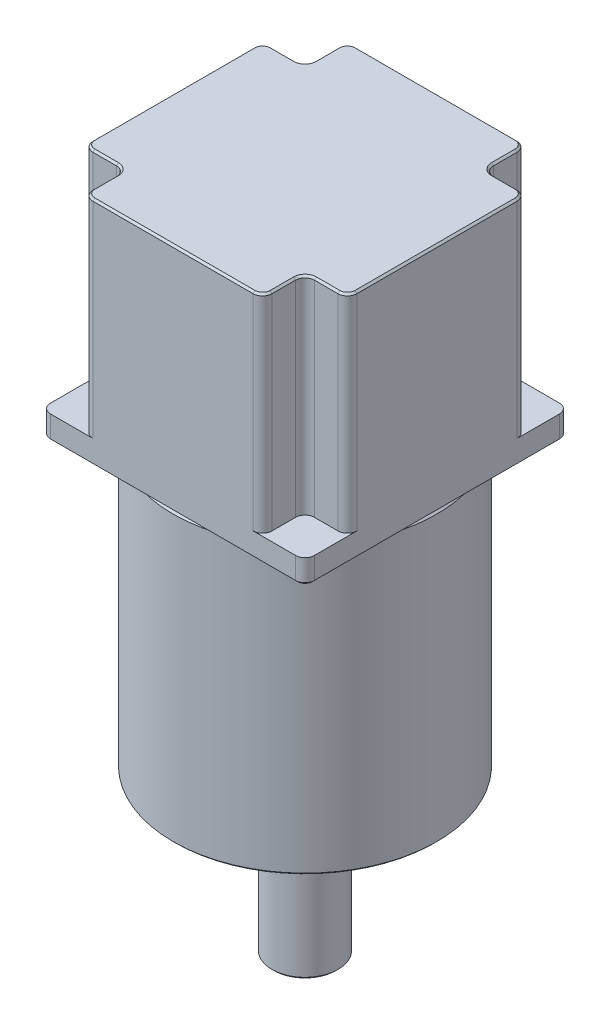
from build123d import *

# Parameters (mm, degrees)
SKETCH1_W           = 56
SKETCH1_H           = 56
BOSS_EXTRUDE1_DEPTH = 5
BOSS_EXTRUDE2_DEPTH = 44
FILLET1_R           = 2
CHAMFER1_SIZE       = 0.4
SKETCH3_R           = 28
BOSS_EXTRUDE3_DEPTH = 61
CHAMFER2_SIZE       = 0.4
SKETCH4_R           = 7
BOSS_EXTRUDE4_DEPTH = 34
CHAMFER3_SIZE       = 0.4


with BuildPart() as part:
    # Sketch1 → Boss-Extrude1 (new body)
    with BuildSketch(Plane(origin=(0, 0, 0), x_dir=(1, 0, 0), z_dir=(0, 1, 0))):
        Rectangle(SKETCH1_W, SKETCH1_H)
    extrude(amount=BOSS_EXTRUDE1_DEPTH)

    # Sketch2 → Boss-Extrude2 (add)
    with BuildSketch(Plane(origin=(0, 5, 0), x_dir=(1, 0, 0), z_dir=(0, 1, 0))):
        Polygon((-19, 19), (-28, 19), (-28, 0), (-28, -19), (-19, -19), (-19, -28), (19, -28), (19, -19), (28, -19), (28, 0), (28, 19), (19, 19), (19, 28), (-19, 28), align=None)
    extrude(amount=BOSS_EXTRUDE2_DEPTH)

    # Fillet1
    fillet1_edges = [part.edges().sort_by_distance(p)[0] for p in [
        (-28, 27, 19),
        (-19, 27, 19),
        (-19, 27, 28),
        (19, 27, 28),
        (19, 27, 19),
        (28, 27, 19),
        (28, 27, -19),
        (19, 27, -19),
        (19, 27, -28),
        (-19, 27, -28),
        (-19, 27, -19),
        (-28, 27, -19),
        (28, 2.5, 28),
        (-28, 2.5, 28),
        (-28, 2.5, -28),
        (28, 2.5, -28),
    ]]
    fillet(fillet1_edges, radius=FILLET1_R)

    # Chamfer1
    chamfer1_edges = [part.edges().sort_by_distance(p)[0] for p in [
        (-19.585786438, 49, 19.585786438),
        (19.585786438, 49, 19.585786438),
        (19.585786438, 49, -19.585786438),
        (-19.585786438, 49, -19.585786438),
        (0, 0, 28),
        (0, 49, 28),
        (28, 0, 0),
        (-28, 0, 0),
        (0, 0, -28),
        (-27.414213562, 0, -27.414213562),
        (27.414213562, 0, -27.414213562),
        (27.414213562, 0, 27.414213562),
        (-27.414213562, 0, 27.414213562),
        (-28, 49, 0),
        (-19, 49, 23.5),
        (-23.5, 49, 19),
        (19, 49, 23.5),
        (23.5, 49, 19),
        (28, 49, 0),
        (23.5, 49, -19),
        (19, 49, -23.5),
        (0, 49, -28),
        (-19, 49, -23.5),
        (-23.5, 49, -19),
        (-27.414213562, 49, -18.414213562),
        (-18.414213562, 49, -27.414213562),
        (18.414213562, 49, -27.414213562),
        (27.414213562, 49, -18.414213562),
        (27.414213562, 49, 18.414213562),
        (18.414213562, 49, 27.414213562),
        (-27.414213562, 49, 18.414213562),
        (-18.414213562, 49, 27.414213562),
    ]]
    chamfer(chamfer1_edges, length=CHAMFER1_SIZE)


with BuildPart() as body_2:
    # Sketch3 → Boss-Extrude3 (new body)
    with BuildSketch(Plane.XZ):
        with Locations(Location((0, 0, 0), (0, 0, 90))):
            Circle(SKETCH3_R)
    extrude(amount=BOSS_EXTRUDE3_DEPTH)

    # Chamfer2
    chamfer2_edges = [body_2.edges().sort_by_distance(p)[0] for p in [
        (0, 0, -28),
        (0, -61, -28),
    ]]
    chamfer(chamfer2_edges, length=CHAMFER2_SIZE)


with BuildPart() as body_3:
    # Sketch4 → Boss-Extrude4 (new body)
    with BuildSketch(Plane.XZ.offset(61)):
        with Locations(Location((0, 0, 0), (0, 0, 270))):
            Circle(SKETCH4_R)
    extrude(amount=BOSS_EXTRUDE4_DEPTH)

    # Chamfer3
    chamfer3_edges = [body_3.edges().sort_by_distance(p)[0] for p in [
        (0, -95, 7),
    ]]
    chamfer(chamfer3_edges, length=CHAMFER3_SIZE)


solid = Compound([part.part, body_2.part, body_3.part])
